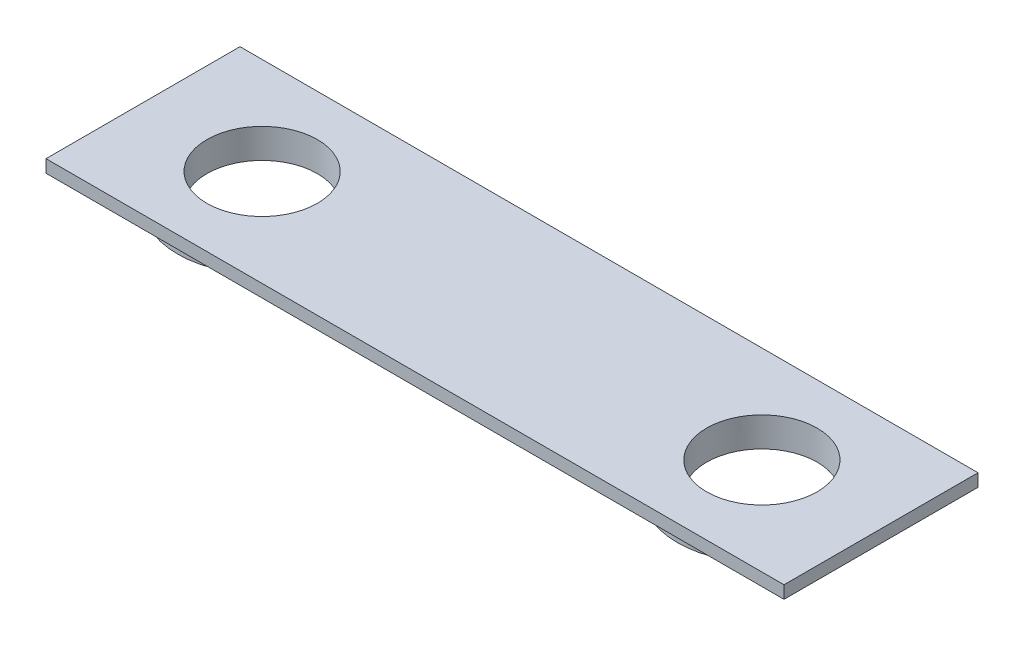
from build123d import *

# Parameters (mm, degrees)
SKETCH1_W           = 87.5
SKETCH1_H           = 23
SKETCH1_R           = 6.55
BOSS_EXTRUDE1_DEPTH = 1.5
BOSS_EXTRUDE2_START = 2
SKETCH2_R           = 10
SKETCH2_R_2         = 6.55
BOSS_EXTRUDE2_DEPTH = 2


with BuildPart() as part:
    # Sketch1 → Boss-Extrude1 (new body)
    with BuildSketch(Plane(origin=(0, 0, 0), x_dir=(1, 0, 0), z_dir=(0, 1, 0))):
        Rectangle(SKETCH1_W, SKETCH1_H)
        with Locations((-29.625, 0)):
            Circle(SKETCH1_R, mode=Mode.SUBTRACT)
        with Locations((29.625, 0)):
            Circle(SKETCH1_R, mode=Mode.SUBTRACT)
    extrude(amount=BOSS_EXTRUDE1_DEPTH)

    # Sketch2 → Boss-Extrude2 (add)
    # profile 1 of 2: a face of its own
    with BuildSketch(Plane.XZ.offset(BOSS_EXTRUDE2_START)):
        with Locations((-29.625, 0)):
            Circle(SKETCH2_R)
        with Locations((-29.625, 0)):
            Circle(SKETCH2_R_2, mode=Mode.SUBTRACT)
    # profile 2 of 2: a face of its own
    with BuildSketch(Plane.XZ.offset(BOSS_EXTRUDE2_START)):
        with Locations((29.625, 0)):
            Circle(SKETCH2_R)
        with Locations((29.625, 0)):
            Circle(SKETCH2_R_2, mode=Mode.SUBTRACT)
    extrude(amount=-BOSS_EXTRUDE2_DEPTH)


solid = part.part
